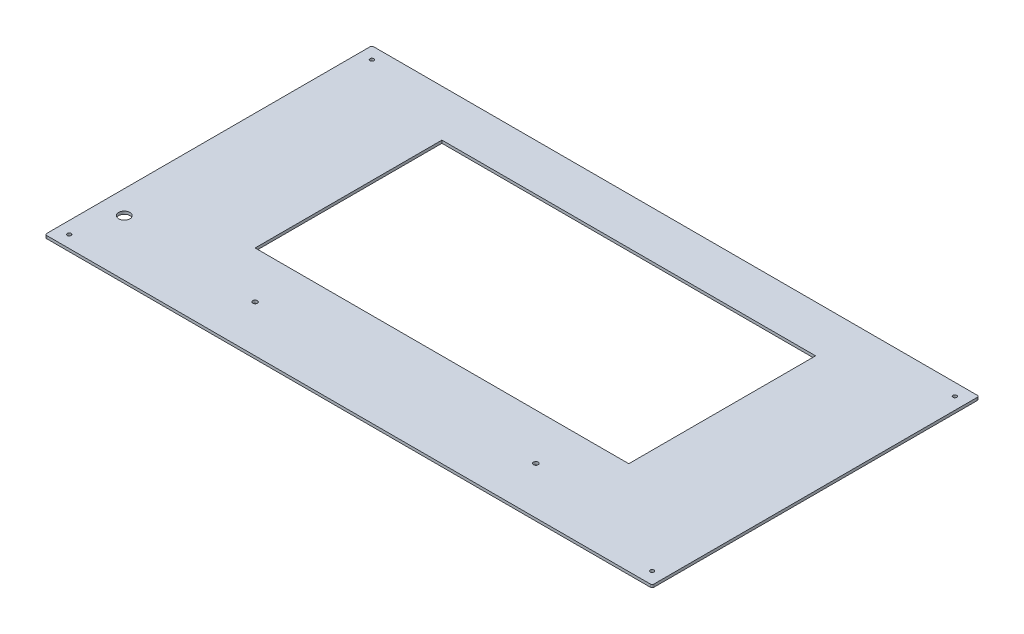
from build123d import *

# Parameters (mm, degrees)
SKETCH_1_R      = 2
SKETCH_1_R_2    = 2.5
SKETCH_1_R_3    = 6
SKETCH_1_W      = 400
SKETCH_1_H      = 200
EXTRUDE_1_DEPTH = 3


with BuildPart() as part:
    # 草图1 → 凸台-拉伸1 (new body)
    with BuildSketch(Plane(origin=(0, 0, 0), x_dir=(1, 0, 0), z_dir=(0, 1, 0))):
        with BuildLine():
            Line((2, 0), (648, 0))
            ThreePointArc((648, 0), (649.414213562, 0.585786438), (650, 2))
            Line((650, 2), (650, 348))
            ThreePointArc((650, 348), (649.414213562, 349.414213562), (648, 350))
            Line((648, 350), (2, 350))
            ThreePointArc((2, 350), (0.585786438, 349.414213562), (0, 348))
            Line((0, 348), (0, 2))
            ThreePointArc((0, 2), (0.585786438, 0.585786438), (2, 0))
        make_face()
        with Locations(Location((13, 13, 0), (0, 0, 270))):
            Circle(SKETCH_1_R, mode=Mode.SUBTRACT)
        with Locations(Location((637, 13, 0), (0, 0, 270))):
            Circle(SKETCH_1_R, mode=Mode.SUBTRACT)
        with Locations(Location((13, 337, 0), (0, 0, 270))):
            Circle(SKETCH_1_R, mode=Mode.SUBTRACT)
        with Locations(Location((637, 337, 0), (0, 0, 270))):
            Circle(SKETCH_1_R, mode=Mode.SUBTRACT)
        with Locations(Location((475, 50.49256144, 0), (0, 0, 270))):
            Circle(SKETCH_1_R_2, mode=Mode.SUBTRACT)
        with Locations(Location((175, 50, 0), (0, 0, 270))):
            Circle(SKETCH_1_R_2, mode=Mode.SUBTRACT)
        with Locations(Location((25, 60, 0), (0, 0, 270))):
            Circle(SKETCH_1_R_3, mode=Mode.SUBTRACT)
        with Locations((325, 200)):
            Rectangle(SKETCH_1_W, SKETCH_1_H, mode=Mode.SUBTRACT)
    extrude(amount=-EXTRUDE_1_DEPTH)


solid = part.part
